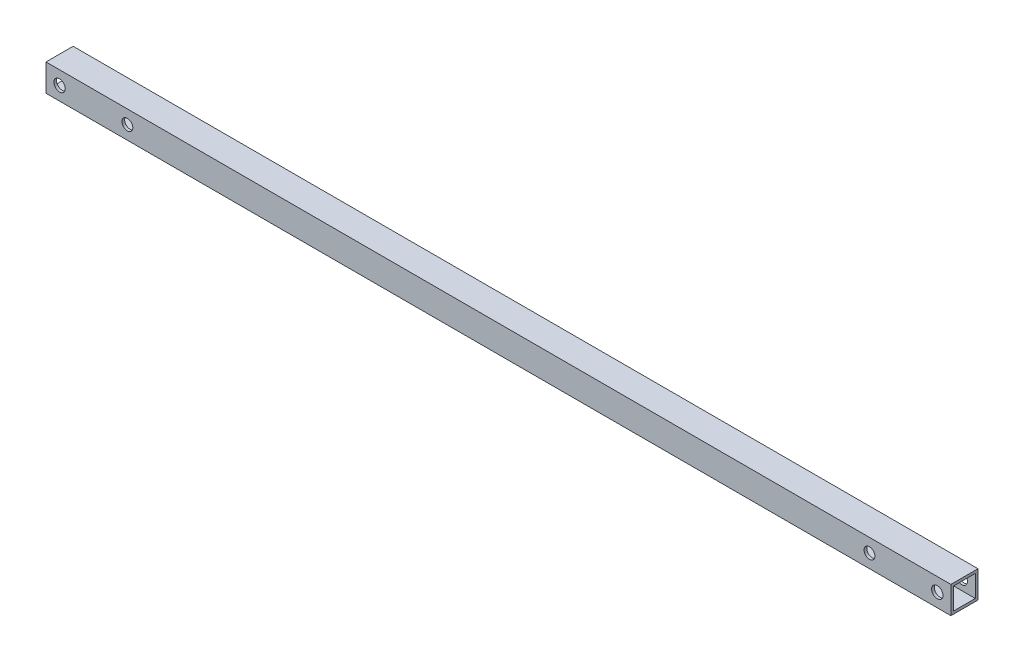
from build123d import *

# Parameters (mm, degrees)
SKETCH_1_W          = 10
SKETCH_1_H          = 10
SKETCH_1_W_2        = 8
SKETCH_1_H_2        = 8
EXTRUDE_1_DEPTH     = 333.544819152
SKETCH_2_R          = 2.1
SKETCH_2_R_2        = 2
CUT_EXTRUDE_1_DEPTH = 334.732147662


with BuildPart() as part:
    # ｽｹｯﾁ1 → 押し出し-薄板1 (new body)
    with BuildSketch(Plane(origin=(0, 0, 0), x_dir=(0, -1, 0), z_dir=(1, 0, 0))):
        Rectangle(SKETCH_1_W, SKETCH_1_H)
        Rectangle(SKETCH_1_W_2, SKETCH_1_H_2, mode=Mode.SUBTRACT)
    extrude(amount=EXTRUDE_1_DEPTH)

    # ｽｹｯﾁ2 → ｶｯﾄ - 押し出し1 (cut, through all)
    with BuildSketch(Plane.XY.offset(5)):
        with Locations((5, 0)):
            Circle(SKETCH_2_R)
        with Locations(Location((328.544819152, 0, 0), (0, 0, 180))):
            Circle(SKETCH_2_R)
        with Locations((30, 0)):
            Circle(SKETCH_2_R_2)
        with Locations(Location((303.544819152, 0, 0), (0, 0, 180))):
            Circle(SKETCH_2_R_2)
    extrude(amount=-CUT_EXTRUDE_1_DEPTH, mode=Mode.SUBTRACT)


solid = part.part
